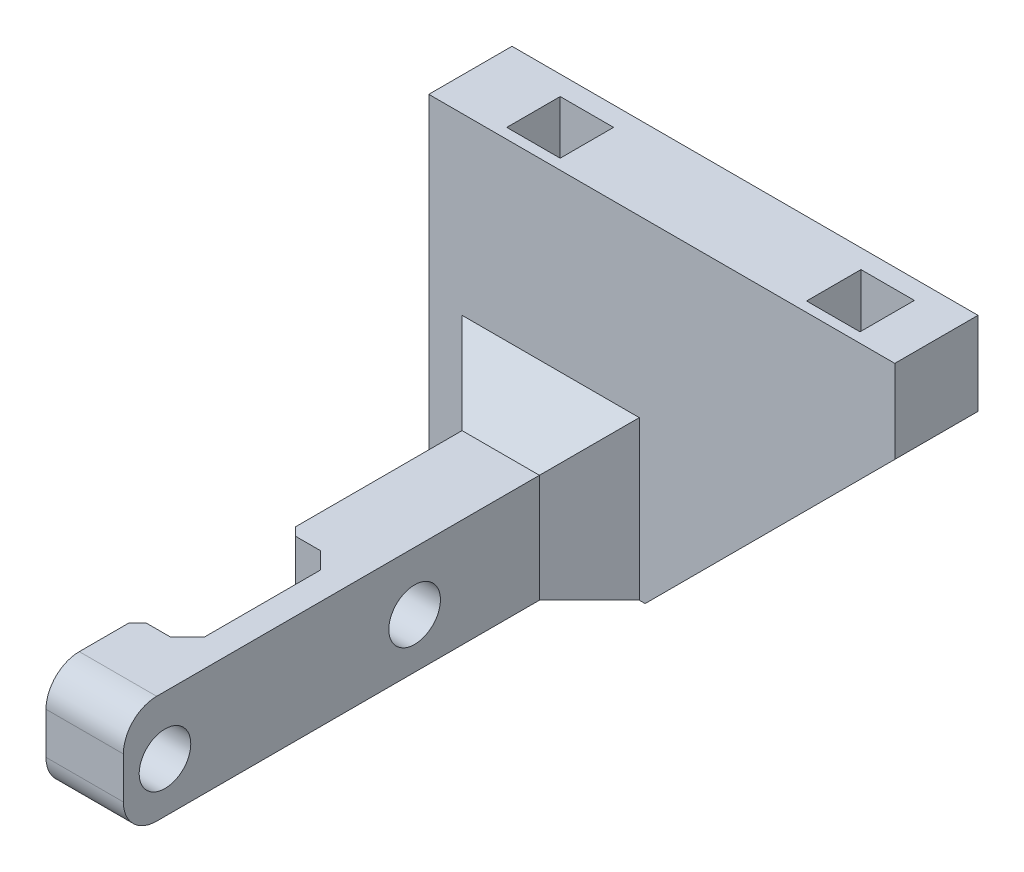
from build123d import *

# Parameters (mm, degrees)
SKETCH1_W           = 28
SKETCH1_H           = 5
BOSS_EXTRUDE1_DEPTH = 20
CHAMFER1_SIZE       = 15
BOSS_EXTRUDE2_DEPTH = 28
SKETCH3_W           = 3
SKETCH3_H           = 9
CUT_EXTRUDE1_DEPTH  = 12.8
CHAMFER2_SIZE       = 1
FILLET1_R           = 2
CHAMFER3_SIZE       = 0.5
CUT_EXTRUDE2_DEPTH  = 12.8
CHAMFER4_SIZE       = 3
CHAMFER5_SIZE       = 3
SKETCH8_W           = 3.20799886
SKETCH8_H           = 3.210000155
SKETCH8_W_2         = 3.209995615
SKETCH8_H_2         = 3.268000248
CUT_EXTRUDE3_DEPTH  = 5.4


with BuildPart() as part:
    # Sketch1 → Boss-Extrude1 (new body)
    with BuildSketch(Plane(origin=(0, 0, 0), x_dir=(1, 0, 0), z_dir=(0, 1, 0))):
        with Locations((14, 2.5)):
            Rectangle(SKETCH1_W, SKETCH1_H)
    extrude(amount=BOSS_EXTRUDE1_DEPTH)

    # Chamfer1
    chamfer1_edges = [part.edges().sort_by_distance(p)[0] for p in [
        (28, 0, -2.5),
    ]]
    chamfer(chamfer1_edges, length=CHAMFER1_SIZE)

    # Sketch2 → Boss-Extrude2 (add)
    with BuildSketch(Plane.XY):
        Polygon((9.648757297, 6.5), (5, 6.5), (5, 2), (5, 0), (9.648757297, 0), align=None)
    extrude(amount=BOSS_EXTRUDE2_DEPTH)

    # Sketch3 → Cut-Extrude1 (cut)
    with BuildSketch(Plane.XZ):
        with Locations((6.5, 18)):
            Rectangle(SKETCH3_W, SKETCH3_H)
    extrude(amount=-CUT_EXTRUDE1_DEPTH, mode=Mode.SUBTRACT)

    # Chamfer2
    chamfer2_edges = [part.edges().sort_by_distance(p)[0] for p in [
        (8, 3.25, 22.5),
        (8, 3.25, 13.5),
    ]]
    chamfer(chamfer2_edges, length=CHAMFER2_SIZE)

    # Fillet1
    fillet1_edges = [part.edges().sort_by_distance(p)[0] for p in [
        (7.324378649, 6.5, 28),
        (7.324378649, 0, 28),
    ]]
    fillet(fillet1_edges, radius=FILLET1_R)

    # Chamfer3
    chamfer3_edges = [part.edges().sort_by_distance(p)[0] for p in [
        (5, 3.25, 13.5),
        (5, 3.25, 22.5),
    ]]
    chamfer(chamfer3_edges, length=CHAMFER3_SIZE)

    # Sketch4 → Cut-Extrude2 (cut)
    with BuildSketch(Plane.ZY.offset(-5)):
        with BuildLine():
            ThreePointArc((25.5, 1.45), (27.05, 3), (25.5, 4.55))
            ThreePointArc((25.5, 4.55), (23.95, 3), (25.5, 1.45))
        make_face()
        with BuildLine():
            ThreePointArc((10.5, 4.55), (8.95, 3), (10.5, 1.45))
            ThreePointArc((10.5, 1.45), (12.05, 3), (10.5, 4.55))
        make_face()
    extrude(amount=-CUT_EXTRUDE2_DEPTH, mode=Mode.SUBTRACT)

    # Chamfer4
    chamfer4_edges = [part.edges().sort_by_distance(p)[0] for p in [
        (5, 3.25, 0),
        (9.648757297, 3.25, 0),
    ]]
    chamfer(chamfer4_edges, length=CHAMFER4_SIZE)

    # Chamfer5
    chamfer5_edges = [part.edges().sort_by_distance(p)[0] for p in [
        (7.324378649, 6.5, 0),
    ]]
    chamfer(chamfer5_edges, length=CHAMFER5_SIZE)

    # Sketch8 → Cut-Extrude3 (cut)
    # profile 1 of 4: a face of its own
    with BuildSketch(Plane(origin=(0, 20, 0), x_dir=(1, 0, 0), z_dir=(0, 1, 0))):
        with Locations((5.668003112, 2.226999903)):
            Rectangle(SKETCH8_W, SKETCH8_H)
        Polygon((7.122002542, 3.68199998), (6.328001618, 3.68199998), (4.214003682, 3.68199998), (4.214003682, 2.801999915), (4.214003682, 2.091999864), (4.214003682, 0.771999825), (4.858002067, 0.771999825), (6.60200417, 0.771999825), (7.122002542, 0.771999825), (7.122002542, 3.48399987), align=None, mode=Mode.SUBTRACT)
    # profile 2 of 4: a face of its own
    with BuildSketch(Plane(origin=(0, 20, 0), x_dir=(1, 0, 0), z_dir=(0, 1, 0))):
        Polygon((7.122002542, 3.68199998), (7.122002542, 3.48399987), (7.122002542, 0.771999825), (6.60200417, 0.771999825), (4.858002067, 0.771999825), (4.214003682, 0.771999825), (4.214003682, 2.091999864), (4.214003682, 2.801999915), (4.214003682, 3.68199998), (6.328001618, 3.68199998), align=None)
    # profile 3 of 4: a face of its own
    with BuildSketch(Plane(origin=(0, 20, 0), x_dir=(1, 0, 0), z_dir=(0, 1, 0))):
        with Locations((23.709002883, 2.229999751)):
            Rectangle(SKETCH8_W_2, SKETCH8_H_2)
        Polygon((22.254005075, 1.15799997), (22.254005075, 1.283999765), (22.254005075, 3.713999875), (25.16400069, 3.713999875), (25.16400069, 0.749999657), (25.16400069, 0.745999627), (24.429999292, 0.745999627), (22.254005075, 0.745999627), align=None, mode=Mode.SUBTRACT)
    # profile 4 of 4: a face of its own
    with BuildSketch(Plane(origin=(0, 20, 0), x_dir=(1, 0, 0), z_dir=(0, 1, 0))):
        Polygon((22.254005075, 3.713999875), (22.254005075, 1.283999765), (22.254005075, 1.15799997), (22.254005075, 0.745999627), (24.429999292, 0.745999627), (25.16400069, 0.745999627), (25.16400069, 0.749999657), (25.16400069, 3.713999875), align=None)
    extrude(amount=-CUT_EXTRUDE3_DEPTH, mode=Mode.SUBTRACT)


solid = part.part
